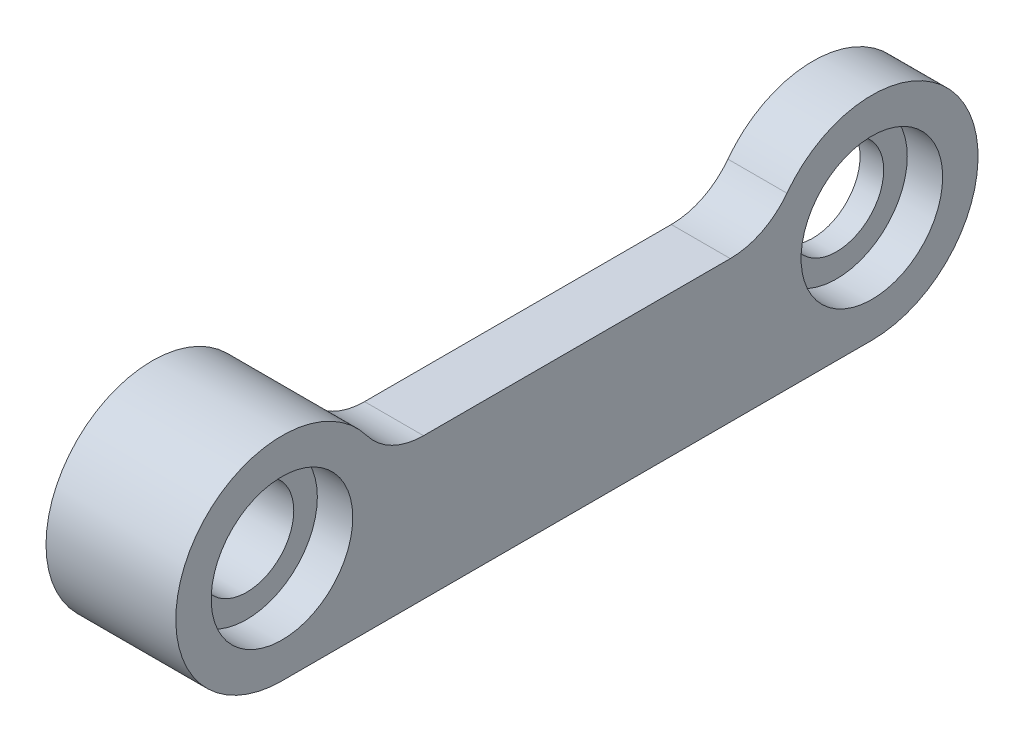
from build123d import *

# Parameters (mm, degrees)
SKETCH_1_R               = 4.5
SKETCH_1_W               = 25
SKETCH_1_H               = 6
EXTRUDE_1_DEPTH          = 2.5
EXTRUDE_START            = -3
SKETCH_1_5_R             = 4.5
EXTRUDE_3_DEPTH          = 3
CUT_EXTRUDE_2_DEPTH      = 31.253099015
CUT_EXTRUDE_2_DEPTH_BACK = 31.253099015
SKETCH_1_4_R             = 2
FILLET_1_R               = 3
SKETCH_2_R               = 3
CUT_EXTRUDE_3_DEPTH      = 1.5


with BuildPart() as part:
    # 草图1 → 凸台-拉伸1 (new body)
    with BuildSketch(Plane(origin=(0, 0, 0), x_dir=(0, 0, -1), z_dir=(1, 0, 0))):
        with Locations((0, -1.5)):
            Circle(SKETCH_1_R)
        with Locations((25, -1.5)):
            Circle(SKETCH_1_R)
        with Locations((12.5, -3)):
            Rectangle(SKETCH_1_W, SKETCH_1_H)
    extrude(amount=EXTRUDE_1_DEPTH)

    # 草图1<5> → 凸台-拉伸3 (add)
    with BuildSketch(Plane(origin=(0, 0, 0), x_dir=(0, 0, -1), z_dir=(1, 0, 0)).offset(EXTRUDE_START)):
        with Locations((0, -1.5)):
            Circle(SKETCH_1_5_R)
    extrude(amount=EXTRUDE_3_DEPTH)

    # 草图1<4> → 切除-拉伸2 (cut, two sides: drawn at the far end of the back side and taken through both)
    with BuildSketch(Plane(origin=(0, 0, 0), x_dir=(0, 0, -1), z_dir=(1, 0, 0)).offset(-CUT_EXTRUDE_2_DEPTH_BACK)):
        with Locations((0, -1.5)):
            Circle(SKETCH_1_4_R)
        with Locations((25, -1.5)):
            Circle(SKETCH_1_4_R)
    extrude(amount=CUT_EXTRUDE_2_DEPTH + CUT_EXTRUDE_2_DEPTH_BACK, mode=Mode.SUBTRACT)

    # 圆角1
    fillet_1_edges = [part.edges().sort_by_distance(p)[0] for p in [
        (1.25, 0, -20.757359313),
        (1.25, 0, -4.242640687),
    ]]
    fillet(fillet_1_edges, radius=FILLET_1_R)

    # 草图2 → 切除-拉伸3 (cut)
    with BuildSketch(Plane(origin=(2.5, 0, 0), x_dir=(0, 0, -1), z_dir=(1, 0, 0))):
        with Locations((0, -1.5)):
            Circle(SKETCH_2_R)
        with Locations((25, -1.5)):
            Circle(SKETCH_2_R)
    extrude(amount=-CUT_EXTRUDE_3_DEPTH, mode=Mode.SUBTRACT)


solid = part.part
